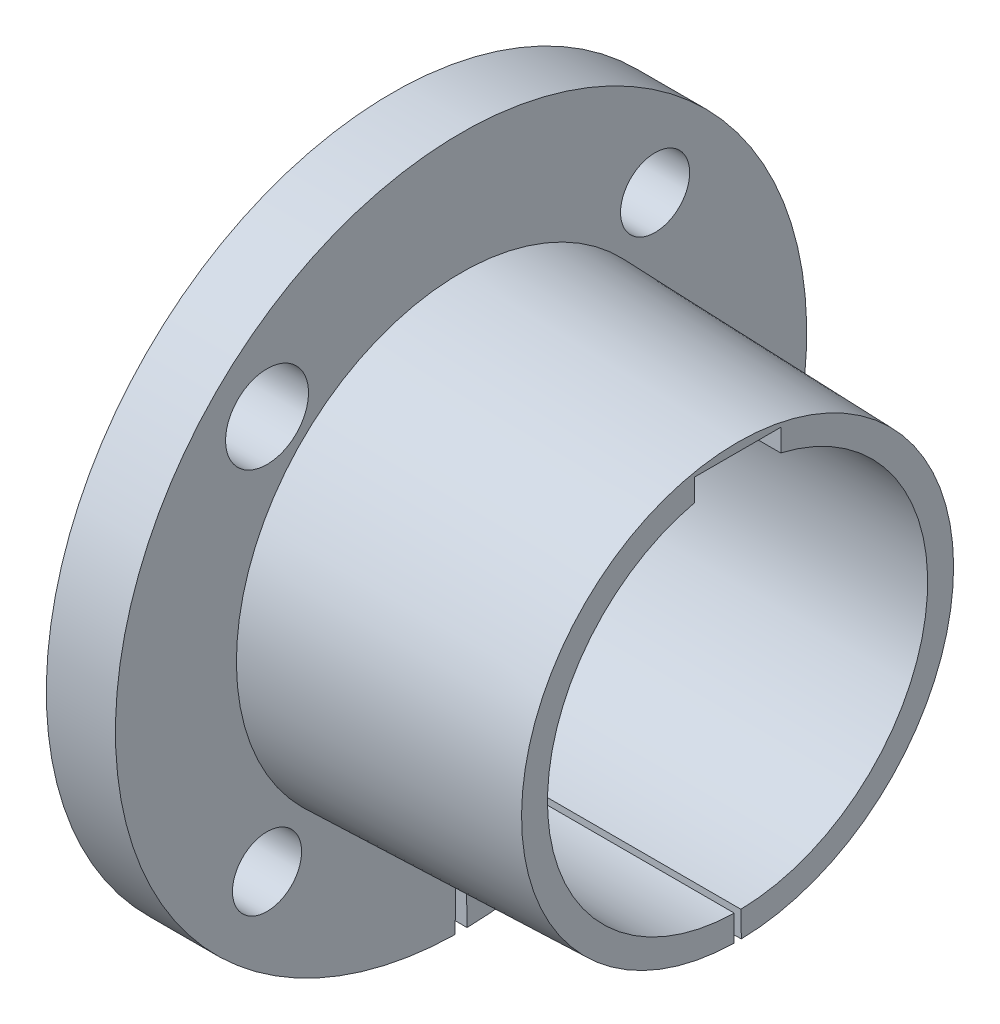
from build123d import *

# Parameters (mm, degrees)
SKETCH1_W                = 31.75
SKETCH1_H                = 14.2875
REVOLVE1_ANGLE           = 358
CUT_EXTRUDE1_DEPTH       = 55.99261314
CUT_EXTRUDE2_START       = -25.4
CUT_EXTRUDE2_DEPTH       = 25.4
DRAFT1_ANGLE             = 1.79
M7_CLEARANCE_HOLE1_D     = 7.62
M7_CLEARANCE_HOLE1_DEPTH = 31.75
HOLE1_D                  = 6.35
HOLE1_DEPTH              = 31.75


with BuildPart() as part:
    # Sketch1 → Revolve1 (revolve)
    with BuildSketch(Plane(origin=(0, 0, 0), x_dir=(1, 0, 0), z_dir=(0, -0.017452406437279848, -0.9998476951563914))):
        with Locations((9.525, 24.60625)):
            Rectangle(SKETCH1_W, SKETCH1_H)
    revolve(axis=Axis((-6.35, 0, 0), (-1, 0, 0)), revolution_arc=REVOLVE1_ANGLE)

    # Sketch2 → Cut-Extrude1 (cut, through all)
    with BuildSketch(Plane.ZY.offset(6.35)):
        with BuildLine():
            Line((3.96875, 17.005526445), (3.96875, 19.05))
            Line((3.96875, 19.05), (-3.96875, 19.05))
            Line((-3.96875, 19.05), (-3.96875, 17.005526445))
            ThreePointArc((-3.96875, 17.005526445), (0, 17.4625), (3.96875, 17.005526445))
        make_face()
    extrude(amount=-CUT_EXTRUDE1_DEPTH, mode=Mode.SUBTRACT)

    # Sketch3 → Cut-Extrude2 (cut)
    with BuildSketch(Plane(origin=(25.4, 0, 0), x_dir=(0, 0, -1), z_dir=(1, 0, 0)).offset(CUT_EXTRUDE2_START)):
        with BuildLine():
            Line((0.360174038, -20.634356809), (0.554113904, -31.745164321))
            ThreePointArc((0.554113904, -31.745164321), (0, 31.75), (-0.554113904, -31.745164321))
            Line((-0.554113904, -31.745164321), (-0.360174038, -20.634356809))
            ThreePointArc((-0.360174038, -20.634356809), (0, 20.6375), (0.360174038, -20.634356809))
        make_face()
    extrude(amount=CUT_EXTRUDE2_DEPTH, mode=Mode.SUBTRACT)

    # Draft1
    draft1_faces = [part.faces().sort_by_distance(p)[0] for p in [
        (12.7, 20.6375, 0),
    ]]
    draft(draft1_faces, Plane(origin=(0, 0, 0), x_dir=(0, 0, 1), z_dir=(1, 0, 0)), DRAFT1_ANGLE)

    # M7 Clearance Hole1
    with Locations(Plane.ZY.offset(6.35)):
        with Locations((-17.823234059, -18.096749091), (17.823234059, 18.096749091)):
            Hole(M7_CLEARANCE_HOLE1_D / 2, depth=M7_CLEARANCE_HOLE1_DEPTH)

    # Hole1
    with Locations(Plane.ZY.offset(6.35)):
        with Locations((-17.823234059, 18.096749091), (17.823234059, -18.096749091)):
            Hole(HOLE1_D / 2, depth=HOLE1_DEPTH)


solid = part.part
